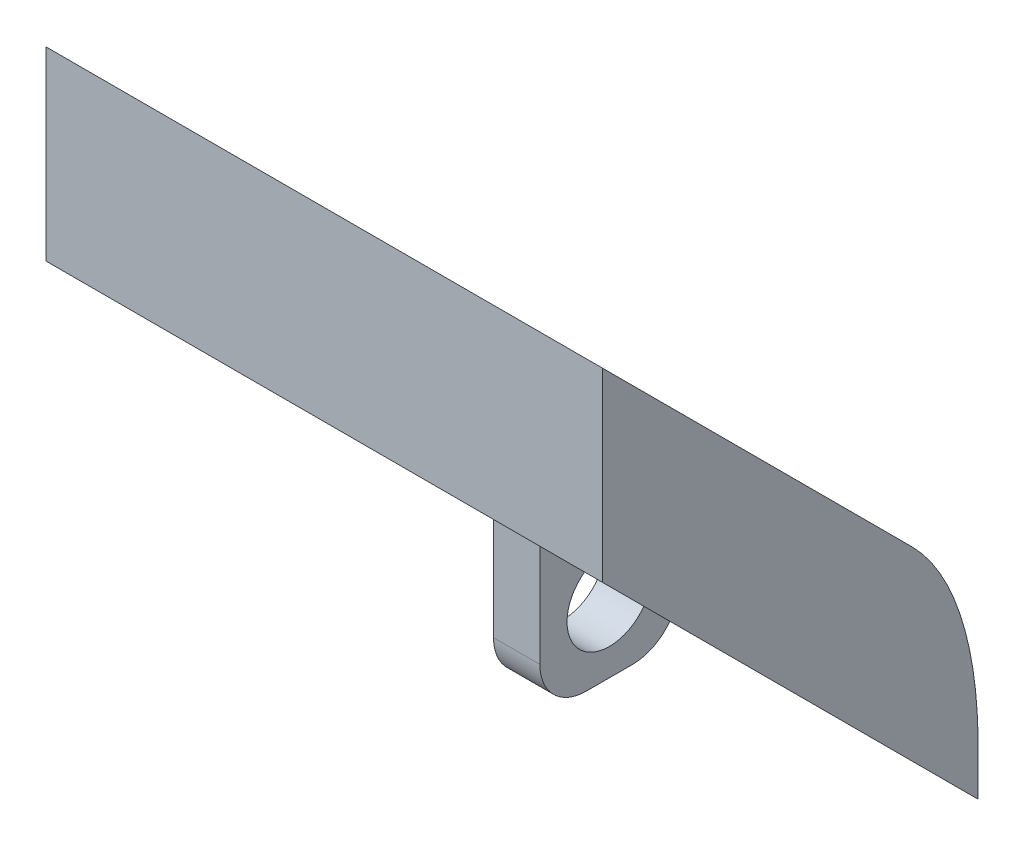
from build123d import *

# Parameters (mm, degrees)
BOSS_EXTRUDE1_DEPTH            = 114.3
CUT_EXTRUDE2_DEPTH             = 161.602521773
CUT_EXTRUDE1_DEPTH             = 158.090324336
FILLET1_R                      = 45.72
SHELL1_T                       = -3.175
SKETCH6_W                      = 6.35
SKETCH6_H                      = 26.924
CUT_EXTRUDE3_REACH             = 145.438
F_1_16_0_457_DOWEL_HOLE1_D     = 11.6078
F_1_16_0_457_DOWEL_HOLE1_DEPTH = 6.35
FILLET2_R                      = 6.35


with BuildPart() as part:
    # Sketch1 → Boss-Extrude1 (new body)
    with BuildSketch(Plane(origin=(0, 0, 0), x_dir=(1, 0, 0), z_dir=(0, 1, 0))):
        Polygon((0, 0), (27.1, 83.2), (49.1, 83.2), (76.2, 0), align=None)
    extrude(amount=BOSS_EXTRUDE1_DEPTH)

    # Sketch5 → Cut-Extrude2 (cut, through all)
    with BuildSketch(Plane.XZ):
        Polygon((49.1, -83.2), (51.380048077, -76.2), (24.819951923, -76.2), (27.1, -83.2), align=None)
    extrude(amount=-CUT_EXTRUDE2_DEPTH, mode=Mode.SUBTRACT)

    # Sketch2 → Cut-Extrude1 (cut, through all)
    with BuildSketch(Plane(origin=(0, 0, 0), x_dir=(0, 0, -1), z_dir=(1, 0, 0))):
        Polygon((0, 114.3), (76.2, 38.1), (76.2, 114.3), align=None)
        Polygon((0, 88.9), (76.2, 12.7), (76.2, 0), (0, 0), align=None)
    extrude(amount=CUT_EXTRUDE1_DEPTH, mode=Mode.SUBTRACT)

    # Fillet1
    fillet1_edges = [part.edges().sort_by_distance(p)[0] for p in [
        (38.1, 38.1, -76.2),
    ]]
    fillet(fillet1_edges, radius=FILLET1_R)

    # Shell1
    shell1_openings = [part.faces().sort_by_distance(p)[0] for p in [
        (38.1, 56.934937611, -31.965062389),
    ]]
    offset(amount=SHELL1_T, openings=shell1_openings, kind=Kind.INTERSECTION)

    # Sweep1: sweep along a path in Sketch7
    with BuildLine(Plane.ZY.offset(-38.1)) as sweep1_path:
        Line((-35.849182435, 73.960689504), (-35.849182435, 23.160689504))
    # Sketch6 → Sweep1 (sweep)
    with BuildSketch(Plane(origin=(0, 54.90493597, -54.90493597), x_dir=(1, 0, 0), z_dir=(0, -0.7071067811865517, 0.7071067811865434))):
        with Locations((38.1, 26.94890509)):
            Rectangle(SKETCH6_W, SKETCH6_H)
    sweep(path=sweep1_path.line)

    # Sketch11 → Cut-Extrude3 (cut, up to next)
    with BuildSketch(Plane.ZY.offset(-34.925), mode=Mode.PRIVATE) as cut_extrude3_sk1:
        Polygon((-26.330110947, 42.210689504), (-45.368253924, 42.210689504), (-45.368253924, 13.641618016), (-26.330110947, 32.679760992), align=None)
    cut_extrude3_tool1 = extrude(cut_extrude3_sk1.sketch, amount=-CUT_EXTRUDE3_REACH, mode=Mode.PRIVATE) & part.part
    add(cut_extrude3_tool1.solids().sort_by_distance((34.925, 31.892927, -37.434707))[0], mode=Mode.SUBTRACT)

    # 1/16 (0.457) Dowel Hole1
    with Locations(Plane.ZY.offset(-34.925)):
        with Locations((-35.849182435, 51.729760992)):
            Hole(F_1_16_0_457_DOWEL_HOLE1_D / 2, depth=F_1_16_0_457_DOWEL_HOLE1_DEPTH)

    # Fillet2
    fillet2_edges = [part.edges().sort_by_distance(p)[0] for p in [
        (38.1, 42.210689504, -26.330110947),
        (38.1, 42.210689504, -45.368253924),
    ]]
    fillet(fillet2_edges, radius=FILLET2_R)


solid = part.part
